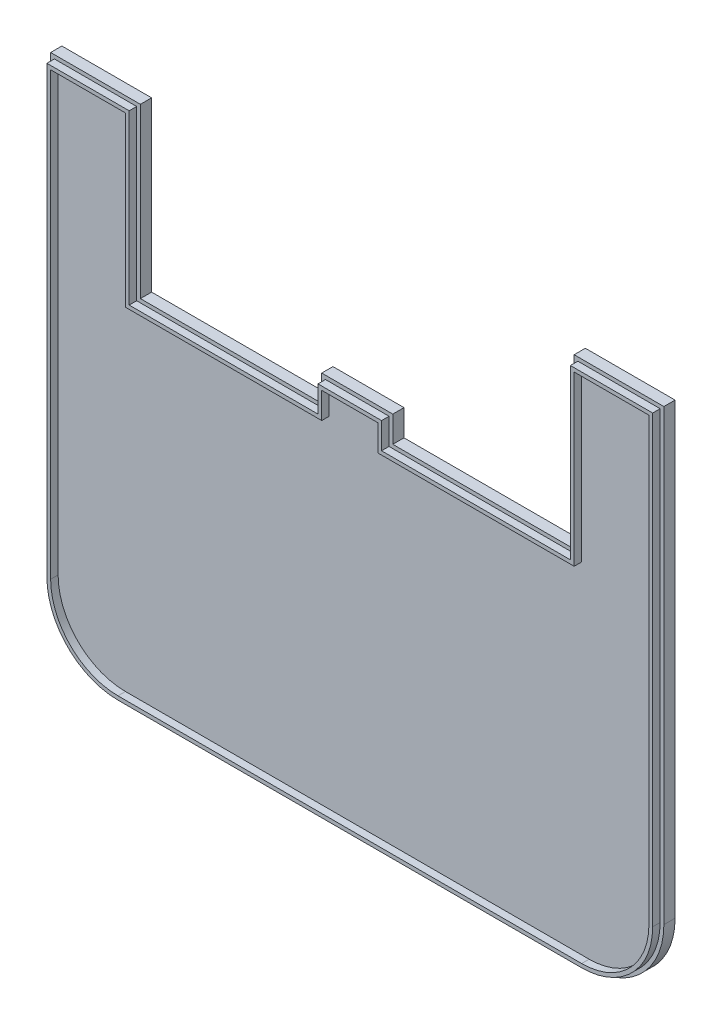
from build123d import *

# Parameters (mm, degrees)
RESSALTO_EXTRUS_O1_DEPTH = 3
RESSALTO_EXTRUS_O2_DEPTH = 2


with BuildPart() as part:
    # Esboço1 → Ressalto-extrusão1 (new body)
    with BuildSketch(Plane.XY):
        with BuildLine():
            Line((-58, 35.5), (-58, 80.5))
            Line((-58, 80.5), (-82, 80.5))
            Line((-82, 80.5), (-82, -39.5))
            ThreePointArc((-82, -39.5), (-76.142135624, -53.642135624), (-62, -59.5))
            Line((-62, -59.5), (62, -59.5))
            ThreePointArc((62, -59.5), (76.142135624, -53.642135624), (82, -39.5))
            Line((82, -39.5), (82, 80.5))
            Line((82, 80.5), (58, 80.5))
            Line((58, 80.5), (58, 35.5))
            Line((58, 35.5), (9.5, 35.5))
            Line((9.5, 35.5), (9.5, 42.5))
            Line((9.5, 42.5), (-9.5, 42.5))
            Line((-9.5, 42.5), (-9.5, 35.5))
            Line((-9.5, 35.5), (-58, 35.5))
        make_face()
    extrude(amount=RESSALTO_EXTRUS_O1_DEPTH)

    # Esboço2 → Ressalto-extrusão2 (add)
    with BuildSketch(Plane.XY.offset(3)):
        with BuildLine():
            Line((-8.5, 34.5), (-59, 34.5))
            Line((-59, 34.5), (-59, 79.5))
            Line((-59, 79.5), (-81, 79.5))
            Line((-81, 79.5), (-81, -39.5))
            ThreePointArc((-81, -39.5), (-75.435028843, -52.935028843), (-62, -58.5))
            Line((-62, -58.5), (62, -58.5))
            ThreePointArc((62, -58.5), (75.435028843, -52.935028843), (81, -39.5))
            Line((81, -39.5), (81, 79.5))
            Line((81, 79.5), (59, 79.5))
            Line((59, 79.5), (59, 34.5))
            Line((59, 34.5), (8.5, 34.5))
            Line((8.5, 34.5), (8.5, 41.5))
            Line((8.5, 41.5), (-8.5, 41.5))
            Line((-8.5, 41.5), (-8.5, 34.5))
        make_face()
        with BuildLine():
            Line((-80, 78.5), (-80, -39.5))
            ThreePointArc((-80, -39.5), (-74.727922061, -52.227922061), (-62, -57.5))
            Line((-62, -57.5), (62, -57.5))
            ThreePointArc((62, -57.5), (74.727922061, -52.227922061), (80, -39.5))
            Line((80, -39.5), (80, 78.5))
            Line((80, 78.5), (60, 78.5))
            Line((60, 78.5), (60, 33.5))
            Line((60, 33.5), (7.5, 33.5))
            Line((7.5, 33.5), (7.5, 40.5))
            Line((7.5, 40.5), (-7.5, 40.5))
            Line((-7.5, 40.5), (-7.5, 33.5))
            Line((-7.5, 33.5), (-60, 33.5))
            Line((-60, 33.5), (-60, 78.5))
            Line((-60, 78.5), (-80, 78.5))
        make_face(mode=Mode.SUBTRACT)
    extrude(amount=RESSALTO_EXTRUS_O2_DEPTH)


solid = part.part
